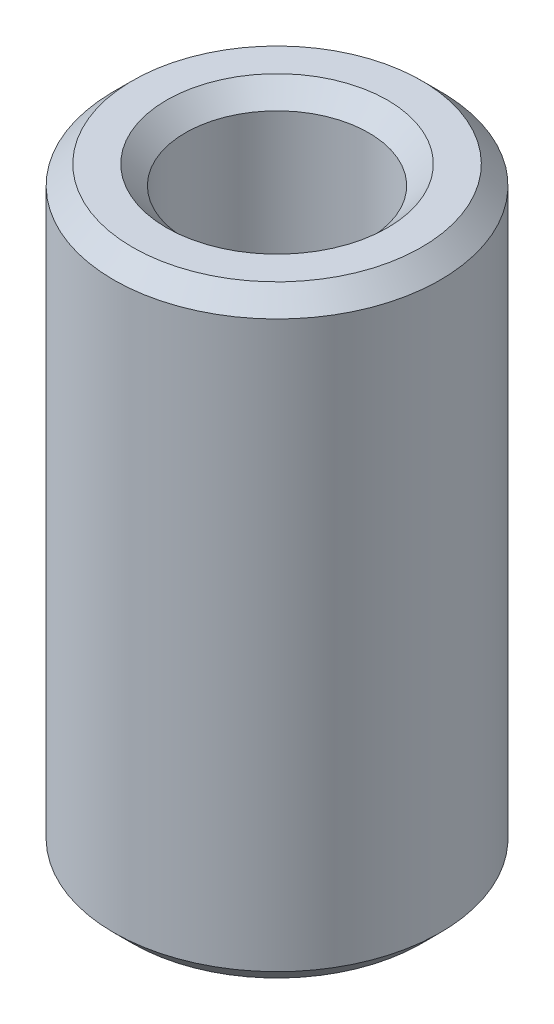
from build123d import *

# Parameters (mm, degrees)
CROQUIS1_R              = 6.5
CROQUIS1_R_2            = 3.65
SALIENTE_EXTRUIR1_DEPTH = 12
CHAFL_N1_SIZE           = 0.75


with BuildPart() as part:
    # Croquis1 → Saliente-Extruir1 (new, symmetric)
    with BuildSketch(Plane(origin=(0, 0, 0), x_dir=(1, 0, 0), z_dir=(0, 1, 0))):
        with Locations(Location((0, 0, 0), (0, 0, 270))):
            Circle(CROQUIS1_R)
        with Locations(Location((0, 0, 0), (0, 0, 270))):
            Circle(CROQUIS1_R_2, mode=Mode.SUBTRACT)
    extrude(amount=SALIENTE_EXTRUIR1_DEPTH, both=True)

    # Chaflán1
    chafl_n1_edges = [part.edges().sort_by_distance(p)[0] for p in [
        (0, -12, -6.5),
        (0, 12, -6.5),
        (0, -12, -3.65),
        (0, 12, -3.65),
    ]]
    chamfer(chafl_n1_edges, length=CHAFL_N1_SIZE)


solid = part.part
